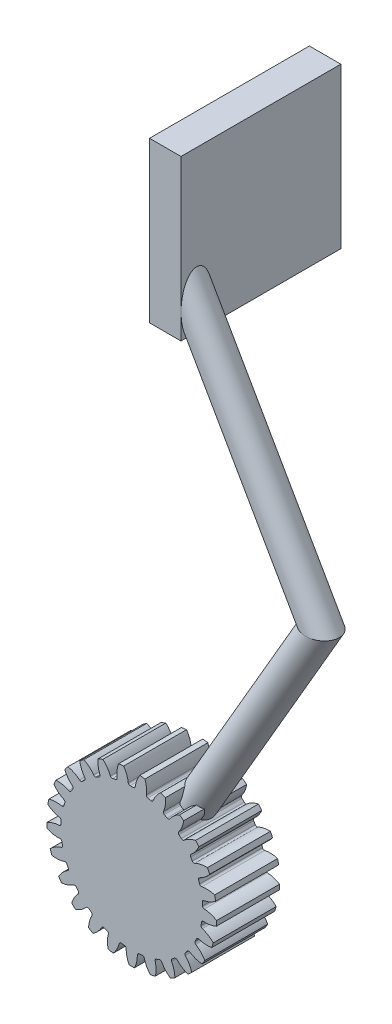
from build123d import *

# Parameters (mm, degrees)
SKETCH1_R                = 27
SKETCH1_R_2              = 25
SKETCH1_R_3              = 22.5
BOSS_EXTRUDE1_DEPTH      = 10
CUT_EXTRUDE2_DEPTH       = 40.471508712
FILLET1_R                = 0.6
CIRPATTERN1_COUNT        = 25
FILLET1_OF_CIRPATTERN1_R = 0.6
SCALE1_SCALE             = 0.5
SKETCH5_R                = 2.5
CUT_EXTRUDE3_DEPTH       = 93.395767455
CUT_EXTRUDE3_DEPTH_BACK  = 93.395767455
SKETCH7_W                = 9.032561648
SKETCH7_H                = 7.938503331
SKETCH8_W                = 25.4
SKETCH8_H                = 25.4
BOSS_EXTRUDE2_DEPTH      = 5


with BuildPart() as part:
    # Sketch1 → Boss-Extrude1 (new, symmetric)
    # profile 1 of 3: a face of its own
    with BuildSketch(Plane.XY):
        Circle(SKETCH1_R)
        Circle(SKETCH1_R_2, mode=Mode.SUBTRACT)
    # profile 2 of 3: a face of its own
    with BuildSketch(Plane.XY):
        Circle(SKETCH1_R_2)
        Circle(SKETCH1_R_3, mode=Mode.SUBTRACT)
    # profile 3 of 3: a face of its own
    with BuildSketch(Plane.XY):
        Circle(SKETCH1_R_3)
    extrude(amount=BOSS_EXTRUDE1_DEPTH, both=True)

    # Sketch2 → Cut-Extrude2 (cut, symmetric)
    with BuildSketch(Plane.XY):
        with BuildLine():
            ThreePointArc((2.569085244, 26.877496182), (0, 27), (-2.569085244, 26.877496182))
            ThreePointArc((-2.569085244, 26.877496182), (-1.510220721, 24.781486697), (-1.072022538, 22.474446994))
            ThreePointArc((-1.072022538, 22.474446994), (0, 22.5), (1.072022538, 22.474446994))
            ThreePointArc((1.072022538, 22.474446994), (1.510220721, 24.781486697), (2.569085244, 26.877496182))
        make_face()
    cut_extrude2 = extrude(amount=CUT_EXTRUDE2_DEPTH, both=True, mode=Mode.SUBTRACT)

    # Fillet1
    fillet1_edges = [part.edges().sort_by_distance(p)[0] for p in [
        (-1.072022538, 22.474446994, 0),
        (1.072022538, 22.474446994, 0),
    ]]
    fillet(fillet1_edges, radius=FILLET1_R)

    # CirPattern1: Cut-Extrude2 ×25 about axis
    cirpattern1_axis = Axis((0, 0, 0), (0, 0, 1))
    for i in range(1, CIRPATTERN1_COUNT):
        add(cut_extrude2.rotate(cirpattern1_axis, i * 360 / CIRPATTERN1_COUNT), mode=Mode.SUBTRACT)

    # Fillet1 of CirPattern1
    fillet1_of_cirpattern1_edges = [part.edges().sort_by_distance(p)[0] for p in [
        (-6.627510666, 21.50176975, 0),
        (-4.550824708, 22.034972078, 0),
        (-11.766567924, 19.178057235, 0),
        (-9.887726902, 20.210958827, 0),
        (-16.166288445, 15.649316851, 0),
        (-14.603346849, 17.117016703, 0),
        (-19.550221608, 11.137272336, 0),
        (-18.401384806, 12.947549467, 0),
        (-21.705742446, 5.92543204, 0),
        (-21.043196081, 7.964540081, 0),
        (-22.497411659, 0.341275057, 0),
        (-22.362785954, 2.481089349, 0),
        (-21.875485757, -5.264325494, 0),
        (-22.277239742, -3.158257351, 0),
        (-19.879042632, -10.539149113, 0),
        (-20.791932626, -8.599159126, 0),
        (-16.63352615, -15.151759232, 0),
        (-18.000191916, -13.499744108, 0),
        (-12.342864045, -18.812328595, 0),
        (-14.077432948, -17.552090519, 0),
        (-7.276654398, -21.290850165, 0),
        (-9.270137095, -20.501574531, 0),
        (-1.753225794, -22.431589318, 0),
        (-3.880364434, -22.162869215, 0),
        (3.880364434, -22.162869215, 0),
        (1.753225794, -22.431589318, 0),
        (9.270137095, -20.501574531, 0),
        (7.276654398, -21.290850165, 0),
        (14.077432948, -17.552090519, 0),
        (12.342864045, -18.812328595, 0),
        (18.000191916, -13.499744108, 0),
        (16.63352615, -15.151759232, 0),
        (20.791932626, -8.599159126, 0),
        (19.879042632, -10.539149113, 0),
        (22.277239742, -3.158257351, 0),
        (21.875485757, -5.264325494, 0),
        (22.362785954, 2.481089349, 0),
        (22.497411659, 0.341275057, 0),
        (21.043196081, 7.964540081, 0),
        (21.705742446, 5.92543204, 0),
        (18.401384806, 12.947549467, 0),
        (19.550221608, 11.137272336, 0),
        (14.603346849, 17.117016703, 0),
        (16.166288445, 15.649316851, 0),
        (9.887726902, 20.210958827, 0),
        (11.766567924, 19.178057235, 0),
        (4.550824708, 22.034972078, 0),
        (6.627510666, 21.50176975, 0),
    ]]
    fillet(fillet1_of_cirpattern1_edges, radius=FILLET1_OF_CIRPATTERN1_R)


with BuildPart() as part_1:
    # Scale1: scaled about (0, 0, 0)
    add(part.part.scale(SCALE1_SCALE))

    # Sweep1: sweep along a path in Sketch4
    with BuildLine(Plane.XY) as sweep1_path:
        Line((0, 0), (25.098212624, 43.244418404))
        Line((25.098212624, 43.244418404), (0.325, 86.675834871))
    # Sketch5 → Sweep1 (sweep)
    with BuildSketch(Plane(origin=(0.325, 86.675834871, 0), x_dir=(0.8686283293329469, 0.4954642524746399, 0), z_dir=(-0.4954642524746399, 0.8686283293329469, 0))):
        Circle(SKETCH5_R)
    sweep(path=sweep1_path.line, transition=Transition.RIGHT)

    # Sketch7 → Cut-Extrude3 (cut, two sides: drawn at the far end of the back side and taken through both)
    with BuildSketch(Plane.XY.offset(-CUT_EXTRUDE3_DEPTH_BACK)):
        with Locations((-4.191280824, 82.706583206)):
            Rectangle(SKETCH7_W, SKETCH7_H)
    extrude(amount=CUT_EXTRUDE3_DEPTH + CUT_EXTRUDE3_DEPTH_BACK, mode=Mode.SUBTRACT)

    # Sketch8 → Boss-Extrude2 (add)
    with BuildSketch(Plane.ZY.offset(-0.325)):
        with Locations((-10.2, 86.675834871)):
            Rectangle(SKETCH8_W, SKETCH8_H)
    extrude(amount=-BOSS_EXTRUDE2_DEPTH)


solid = part_1.part
